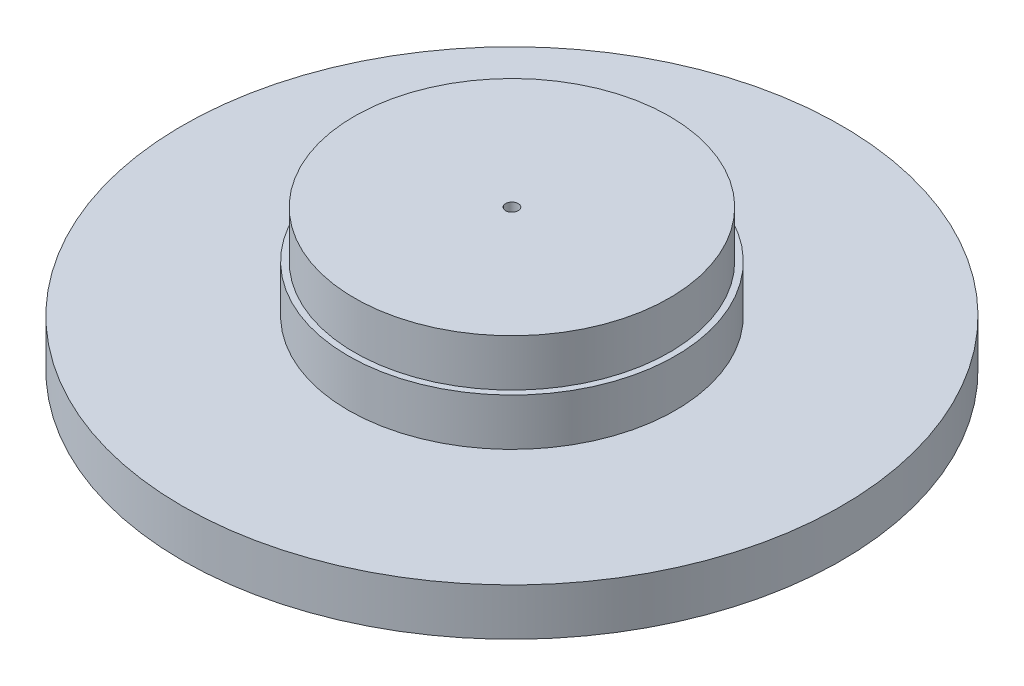
from build123d import *

# Parameters (mm, degrees)
SKETCH1_R                                           = 84.9884
BOSS_EXTRUDE1_DEPTH                                 = 76.2
SKETCH1_3_R                                         = 88.265
SKETCH1_3_R_2                                       = 84.9884
BOSS_EXTRUDE2_DEPTH                                 = 50.8
SKETCH1_4_R                                         = 177.8
SKETCH1_4_R_2                                       = 88.265
BOSS_EXTRUDE3_DEPTH                                 = 25.4
CSK_FOR_1_4_FLAT_HEAD_MACHINE_SCREW_100_D           = 6.7564
CSK_FOR_1_4_FLAT_HEAD_MACHINE_SCREW_100_CSINK_D     = 12.8778
CSK_FOR_1_4_FLAT_HEAD_MACHINE_SCREW_100_CSINK_ANGLE = 100


with BuildPart() as part:
    # Sketch1 → Boss-Extrude1 (new body)
    with BuildSketch(Plane(origin=(0, 0, 0), x_dir=(1, 0, 0), z_dir=(0, 1, 0))):
        Circle(SKETCH1_R)
    extrude(amount=BOSS_EXTRUDE1_DEPTH)

    # Sketch1<3> → Boss-Extrude2 (add)
    with BuildSketch(Plane(origin=(0, 0, 0), x_dir=(1, 0, 0), z_dir=(0, 1, 0))):
        Circle(SKETCH1_3_R)
        Circle(SKETCH1_3_R_2, mode=Mode.SUBTRACT)
    extrude(amount=BOSS_EXTRUDE2_DEPTH)

    # Sketch1<4> → Boss-Extrude3 (add)
    with BuildSketch(Plane(origin=(0, 0, 0), x_dir=(1, 0, 0), z_dir=(0, 1, 0))):
        Circle(SKETCH1_4_R)
        Circle(SKETCH1_4_R_2, mode=Mode.SUBTRACT)
    extrude(amount=BOSS_EXTRUDE3_DEPTH)

    # CSK for 1/4 Flat Head Machine Screw (100)1 (through all)
    with Locations(Plane(origin=(0, 0, 0), x_dir=(-1, 0, 0), z_dir=(0, -1, 0))):
        with Locations((0, 0)):
            CounterSinkHole(CSK_FOR_1_4_FLAT_HEAD_MACHINE_SCREW_100_D / 2, CSK_FOR_1_4_FLAT_HEAD_MACHINE_SCREW_100_CSINK_D / 2, counter_sink_angle=CSK_FOR_1_4_FLAT_HEAD_MACHINE_SCREW_100_CSINK_ANGLE)


solid = part.part
